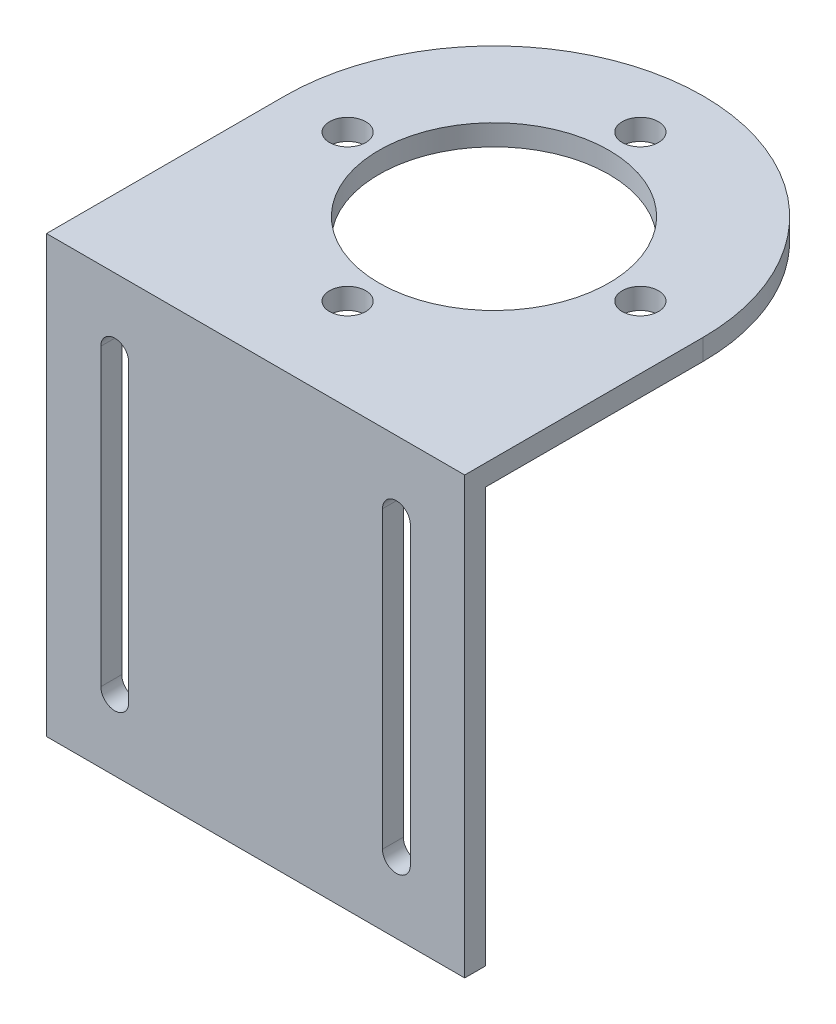
from build123d import *

# Parameters (mm, degrees)
SKETCH1_W           = 60
SKETCH1_H           = 62.5
BOSS_EXTRUDE1_DEPTH = 3
SKETCH2_W           = 60
SKETCH2_H           = 64.2
BOSS_EXTRUDE2_DEPTH = 3
FILLET1_RADIUS      = 30
FILLET1_LENGTH      = 3
SKETCH3_R           = 16.5
SKETCH3_R_2         = 2.6
CUT_EXTRUDE1_DEPTH  = 3


with BuildPart() as part:
    # Sketch1 → Boss-Extrude1 (new body)
    with BuildSketch(Plane.XY):
        with Locations((30, 31.25)):
            Rectangle(SKETCH1_W, SKETCH1_H)
        with BuildLine():
            Line((7.8, 10.1), (7.8, 52.4))
            ThreePointArc((7.8, 52.4), (9.8, 54.4), (11.8, 52.4))
            Line((11.8, 52.4), (11.8, 10.1))
            ThreePointArc((11.8, 10.1), (9.8, 8.1), (7.8, 10.1))
        make_face(mode=Mode.SUBTRACT)
        with BuildLine():
            Line((48.2, 10.1), (48.2, 52.4))
            ThreePointArc((48.2, 52.4), (50.2, 54.4), (52.2, 52.4))
            Line((52.2, 52.4), (52.2, 10.1))
            ThreePointArc((52.2, 10.1), (50.2, 8.1), (48.2, 10.1))
        make_face(mode=Mode.SUBTRACT)
    extrude(amount=BOSS_EXTRUDE1_DEPTH)

    # Sketch2 → Boss-Extrude2 (add)
    with BuildSketch(Plane(origin=(0, 62.5, 0), x_dir=(1, 0, 0), z_dir=(0, 1, 0))):
        with Locations((30, 29.1)):
            Rectangle(SKETCH2_W, SKETCH2_H)
    extrude(amount=-BOSS_EXTRUDE2_DEPTH)

    # Fillet1: full round fillet: the end face becomes a half cylinder, R = half its width
    fillet1_face = Plane((30, 61, -61.2), x_dir=(0, 1, 0), z_dir=(0, 0, -1))  # on the end face: x along it, z out of the body
    fillet1_slab = fillet1_face.offset(-FILLET1_RADIUS / 2) * Box(FILLET1_LENGTH, 2 * FILLET1_RADIUS, FILLET1_RADIUS, mode=Mode.PRIVATE)  # the body's end, R deep
    fillet1_round = Plane((30, 61, -31.2), x_dir=(0, 0, -1), z_dir=(0, 1, 0)) * Cylinder(FILLET1_RADIUS, FILLET1_LENGTH, mode=Mode.PRIVATE)  # its axis R under the face
    add(fillet1_slab - fillet1_round, mode=Mode.SUBTRACT)

    # Sketch3 → Cut-Extrude1 (cut)
    with BuildSketch(Plane(origin=(0, 62.5, 0), x_dir=(1, 0, 0), z_dir=(0, 1, 0))):
        with Locations(Location((30, 31.2, 0), (0, 0, 270))):
            Circle(SKETCH3_R)
        with Locations(Location((30, 52.2, 0), (0, 0, 270))):
            Circle(SKETCH3_R_2)
        with Locations(Location((51, 31.2, 0), (0, 0, 270))):
            Circle(SKETCH3_R_2)
        with Locations(Location((30, 10.2, 0), (0, 0, 270))):
            Circle(SKETCH3_R_2)
        with Locations(Location((9, 31.2, 0), (0, 0, 270))):
            Circle(SKETCH3_R_2)
    extrude(amount=-CUT_EXTRUDE1_DEPTH, mode=Mode.SUBTRACT)


solid = part.part
